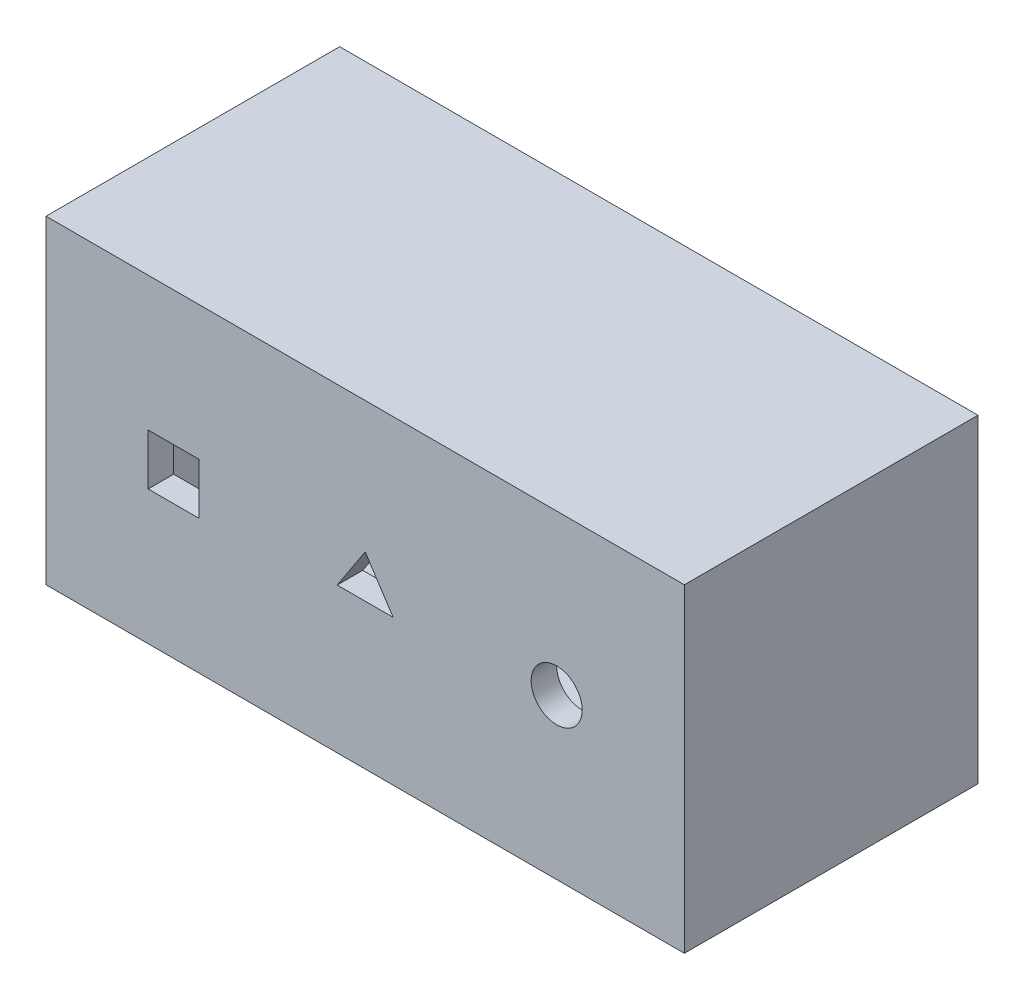
from build123d import *

# Parameters (mm, degrees)
SKETCH1_W           = 250
SKETCH1_H           = 125
SKETCH1_W_2         = 230
SKETCH1_H_2         = 115
BOSS_EXTRUDE1_DEPTH = 100
SKETCH2_W           = 250
SKETCH2_H           = 125
BOSS_EXTRUDE2_DEPTH = 5
SKETCH3_W           = 250
SKETCH3_H           = 125
SKETCH3_W_2         = 230
SKETCH3_H_2         = 115
SKETCH3_R           = 10
SKETCH3_W_3         = 20
SKETCH3_H_3         = 20
BOSS_EXTRUDE4_DEPTH = 10


with BuildPart() as part:
    # Sketch1 → Boss-Extrude1 (new body)
    with BuildSketch(Plane.XY):
        Rectangle(SKETCH1_W, SKETCH1_H)
        Rectangle(SKETCH1_W_2, SKETCH1_H_2, mode=Mode.SUBTRACT)
    extrude(amount=BOSS_EXTRUDE1_DEPTH)

    # Sketch2 → Boss-Extrude2 (add)
    with BuildSketch(Plane(origin=(0, 0, 0), x_dir=(-1, 0, 0), z_dir=(0, 0, -1))):
        Rectangle(SKETCH2_W, SKETCH2_H)
    extrude(amount=BOSS_EXTRUDE2_DEPTH)

    # Sketch3 → Boss-Extrude4 (add)
    # profile 1 of 2: a face of its own
    with BuildSketch(Plane.XY.offset(100)):
        Rectangle(SKETCH3_W, SKETCH3_H)
        Rectangle(SKETCH3_W_2, SKETCH3_H_2, mode=Mode.SUBTRACT)
    # profile 2 of 2: a face of its own
    with BuildSketch(Plane.XY.offset(100)):
        Rectangle(SKETCH3_W_2, SKETCH3_H_2)
        with Locations((75, 0)):
            Circle(SKETCH3_R, mode=Mode.SUBTRACT)
        with Locations((-75, 0)):
            Rectangle(SKETCH3_W_3, SKETCH3_H_3, mode=Mode.SUBTRACT)
        Polygon((0, 11.153858408), (10.958136059, -5.576929204), (-10.958136059, -5.576929204), align=None, mode=Mode.SUBTRACT)
    extrude(amount=BOSS_EXTRUDE4_DEPTH)


solid = part.part
